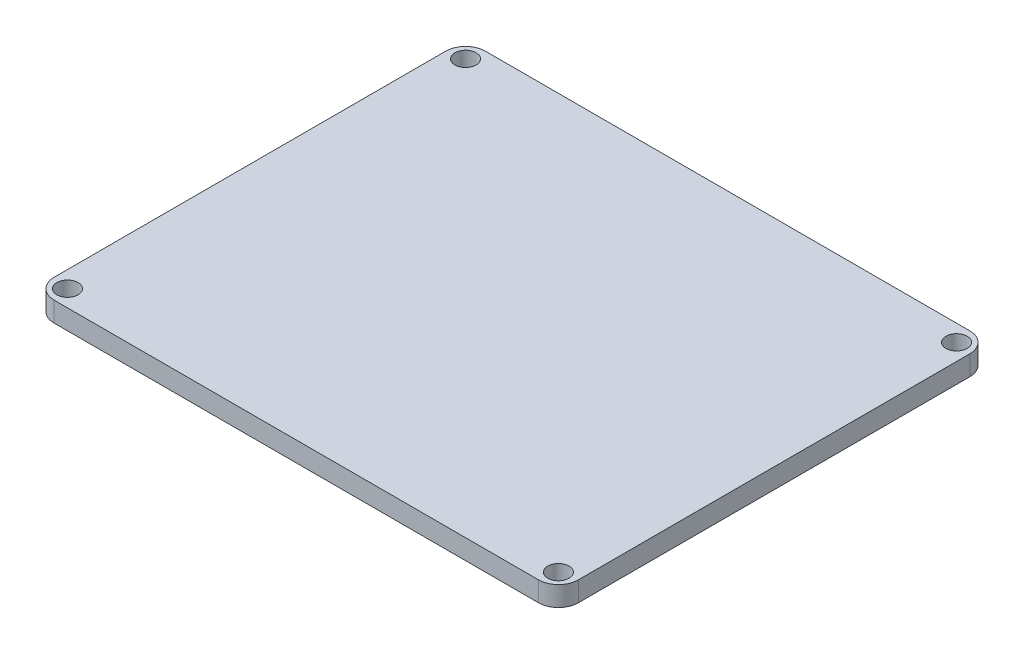
from build123d import *

# Parameters (mm, degrees)
SKETCH_2_W      = 79
SKETCH_2_H      = 65
SKETCH_2_R      = 1.6
EXTRUDE_2_DEPTH = 3
FILLET_1_R      = 3


with BuildPart() as part:
    # 草图2 → 凸台-拉伸2 (new body)
    with BuildSketch(Plane(origin=(0, 0, 0), x_dir=(1, 0, 0), z_dir=(0, 1, 0))):
        with Locations((37, 30)):
            Rectangle(SKETCH_2_W, SKETCH_2_H)
        with Locations(Location((0, 60, 0), (0, 0, 270))):
            Circle(SKETCH_2_R, mode=Mode.SUBTRACT)
        with Locations(Location((74, 60, 0), (0, 0, 270))):
            Circle(SKETCH_2_R, mode=Mode.SUBTRACT)
        with Locations(Location((74, 0, 0), (0, 0, 270))):
            Circle(SKETCH_2_R, mode=Mode.SUBTRACT)
        with Locations(Location((0, 0, 0), (0, 0, 270))):
            Circle(SKETCH_2_R, mode=Mode.SUBTRACT)
    extrude(amount=EXTRUDE_2_DEPTH)

    # 圆角1
    fillet_1_edges = [part.edges().sort_by_distance(p)[0] for p in [
        (-2.5, 1.5, -62.5),
        (76.5, 1.5, -62.5),
        (76.5, 1.5, 2.5),
        (-2.5, 1.5, 2.5),
    ]]
    fillet(fillet_1_edges, radius=FILLET_1_R)


solid = part.part
